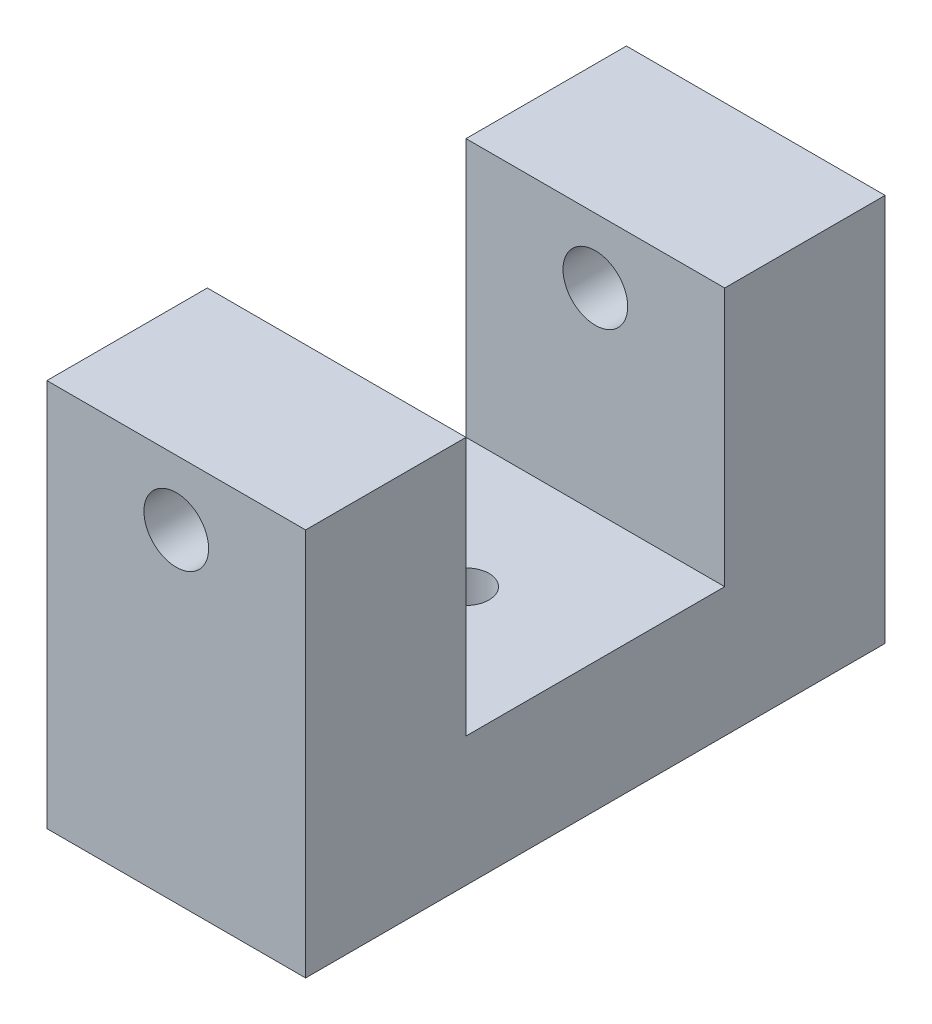
from build123d import *

# Parameters (mm, degrees)
SKETCH1_W             = 12.7
SKETCH1_H             = 28.448
BOSS_EXTRUDE1_DEPTH   = 19.05
SKETCH2_W             = 12.7
SKETCH2_H             = 12.7
CUT_EXTRUDE1_DEPTH    = 27.953936188
SKETCH5_R             = 1.5875
CUT_EXTRUDE2_DEPTH    = 35.82116747
F_4_40_TAPPED_HOLE1_D = 2.2606


with BuildPart() as part:
    # Sketch1 → Boss-Extrude1 (new body)
    with BuildSketch(Plane(origin=(0, 0, 0), x_dir=(1, 0, 0), z_dir=(0, 1, 0))):
        Rectangle(SKETCH1_W, SKETCH1_H)
    extrude(amount=BOSS_EXTRUDE1_DEPTH)

    # Sketch2 → Cut-Extrude1 (cut, through all)
    with BuildSketch(Plane(origin=(6.35, 0, 0), x_dir=(0, 0, -1), z_dir=(1, 0, 0))):
        with Locations((0, 12.7)):
            Rectangle(SKETCH2_W, SKETCH2_H)
    extrude(amount=-CUT_EXTRUDE1_DEPTH, mode=Mode.SUBTRACT)

    # Sketch5 → Cut-Extrude2 (cut, through all)
    with BuildSketch(Plane.XY.offset(14.224)):
        with Locations((0, 15.875)):
            Circle(SKETCH5_R)
    extrude(amount=-CUT_EXTRUDE2_DEPTH, mode=Mode.SUBTRACT)

    # #4-40 Tapped Hole1 (through all)
    with Locations(Plane(origin=(0, 0, 0), x_dir=(-1, 0, 0), z_dir=(0, -1, 0))):
        with Locations((0, 0)):
            Hole(F_4_40_TAPPED_HOLE1_D / 2)


solid = part.part
